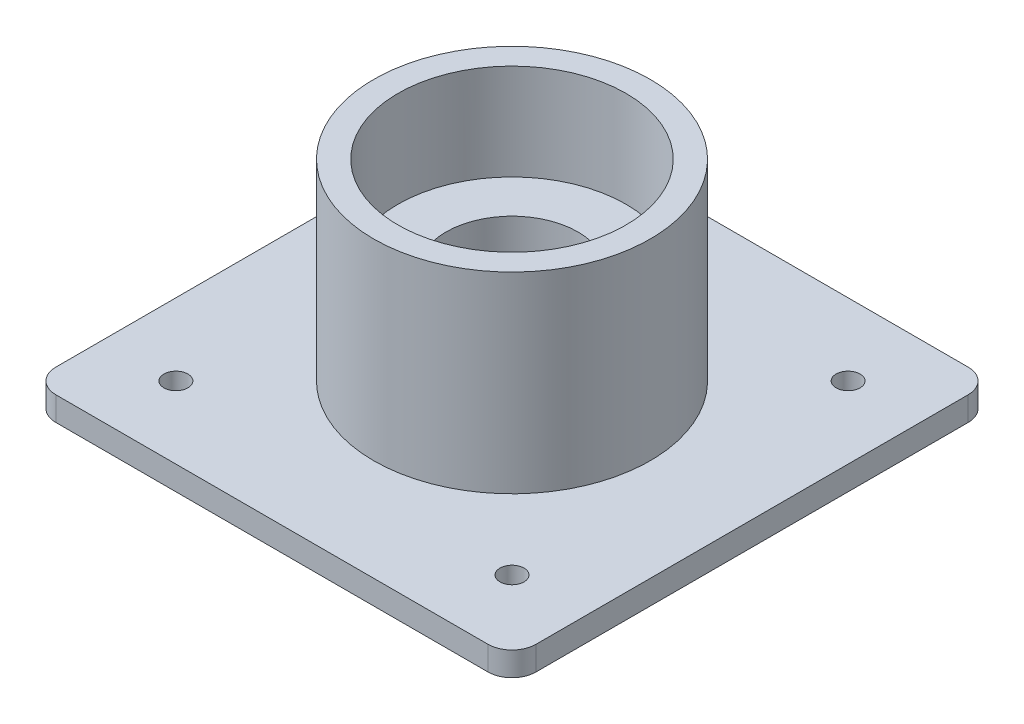
from build123d import *
from build123d.topology import SkipClean

# Parameters (mm, degrees)
SKETCH1_R                   = 30.1625
SKETCH1_R_2                 = 17.4625
ID_2_DEPTH                  = 25.4
SKETCH2_R                   = 36.576
SKETCH2_R_2                 = 30.1625
OD_DEPTH                    = 50.8
BASE_START                  = 6.35
SKETCH3_W                   = 127
SKETCH3_H                   = 127
SKETCH3_R                   = 17.4625
BASE_DEPTH                  = 6.35
BASE_CORNER_FILLET_R        = 6.35
F_1_4_0_25_DIAMETER_HOLE1_D = 6.35
BOLT_PATTERN_COUNT          = 4


with BuildPart() as part:
    # Sketch1 → ID 2 (new body)
    with BuildSketch(Plane(origin=(0, 0, 0), x_dir=(1, 0, 0), z_dir=(0, 1, 0))):
        with Locations(Location((0, 0, 0), (0, 0, 270))):
            Circle(SKETCH1_R)
        with Locations(Location((0, 0, 0), (0, 0, 270))):
            Circle(SKETCH1_R_2, mode=Mode.SUBTRACT)
    extrude(amount=ID_2_DEPTH)

    # Sketch2 → OD (add)
    with BuildSketch(Plane.XZ):
        with Locations(Location((0, 0, 0), (0, 0, 270))):
            Circle(SKETCH2_R)
        with Locations(Location((0, 0, 0), (0, 0, 270))):
            Circle(SKETCH2_R_2, mode=Mode.SUBTRACT)
    extrude(amount=-OD_DEPTH)

    # Sketch3 → Base (add)
    with SkipClean():  # the faces are left unmerged after this step: merging them gives an invalid solid
        with BuildSketch(Plane.XZ.offset(BASE_START)):
            Rectangle(SKETCH3_W, SKETCH3_H)
            with Locations(Location((0, 0, 0), (0, 0, 270))):
                Circle(SKETCH3_R, mode=Mode.SUBTRACT)
        extrude(amount=-BASE_DEPTH)

    # Base corner fillet
    base_corner_fillet_edges = [part.edges().sort_by_distance(p)[0] for p in [
        (63.5, -3.175, -63.5),
        (63.5, -3.175, 63.5),
        (-63.5, -3.175, 63.5),
        (-63.5, -3.175, -63.5),
    ]]
    fillet(base_corner_fillet_edges, radius=BASE_CORNER_FILLET_R)

    # 1/4 (0.25) Diameter Hole1 (through all)
    with Locations(Plane(origin=(0, 0, 0), x_dir=(1, 0, 0), z_dir=(0, 1, 0))):
        with Locations((-44.45, -44.45)):
            f_1_4_0_25_diameter_hole1 = Hole(F_1_4_0_25_DIAMETER_HOLE1_D / 2)

    # Bolt Pattern: 1/4 (0.25) Diameter Hole1 ×4 about axis
    bolt_pattern_axis = Axis((0, 0, 0), (0, 1, 0))
    for i in range(1, BOLT_PATTERN_COUNT):
        add(f_1_4_0_25_diameter_hole1.rotate(bolt_pattern_axis, i * 360 / BOLT_PATTERN_COUNT), mode=Mode.SUBTRACT)


solid = part.part
